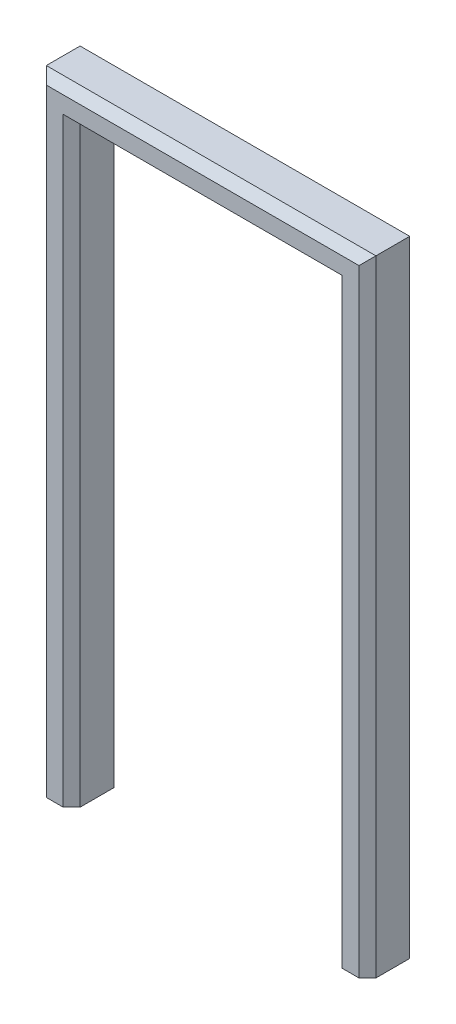
from build123d import *

# Parameters (mm, degrees)
SKETCH1_W             = 8
SKETCH1_H             = 12
BOSS_EXTRUDE1_DEPTH   = 140
BOSS_EXTRUDE1_2_DEPTH = 140
SKETCH2_W             = 78
SKETCH2_H             = 12
BOSS_EXTRUDE2_DEPTH   = 8
CHAMFER1_SIZE         = 2


with BuildPart() as part:
    # Sketch1 → Boss-Extrude1 (new body)
    with BuildSketch(Plane(origin=(0, 0, 0), x_dir=(1, 0, 0), z_dir=(0, 1, 0))):
        with Locations((-35, 0)):
            Rectangle(SKETCH1_W, SKETCH1_H)
    extrude(amount=BOSS_EXTRUDE1_DEPTH)



with BuildPart() as body_2:
    # Sketch1 → Boss-Extrude1 2 (new body)
    with BuildSketch(Plane(origin=(0, 0, 0), x_dir=(1, 0, 0), z_dir=(0, 1, 0))):
        with Locations((35, 0)):
            Rectangle(SKETCH1_W, SKETCH1_H)
    extrude(amount=BOSS_EXTRUDE1_2_DEPTH)


with BuildPart() as part_1:
    add(part.part)

    add(body_2.part)  # Boss-Extrude2 merges body 2
    # Sketch2 → Boss-Extrude2 (add)
    with BuildSketch(Plane(origin=(0, 140, 0), x_dir=(1, 0, 0), z_dir=(0, 1, 0))):
        Rectangle(SKETCH2_W, SKETCH2_H)
    extrude(amount=BOSS_EXTRUDE2_DEPTH)

    # Chamfer1
    chamfer1_edges = [part_1.edges().sort_by_distance(p)[0] for p in [
        (0, 140, 6),
        (39, 74, 6),
        (39, 74, -6),
        (0, 148, 6),
        (0, 148, -6),
        (0, 140, -6),
        (31, 70, -6),
        (31, 70, 6),
        (-31, 70, 6),
        (-39, 74, 6),
        (-39, 74, -6),
        (-31, 70, -6),
    ]]
    chamfer(chamfer1_edges, length=CHAMFER1_SIZE)


solid = part_1.part
